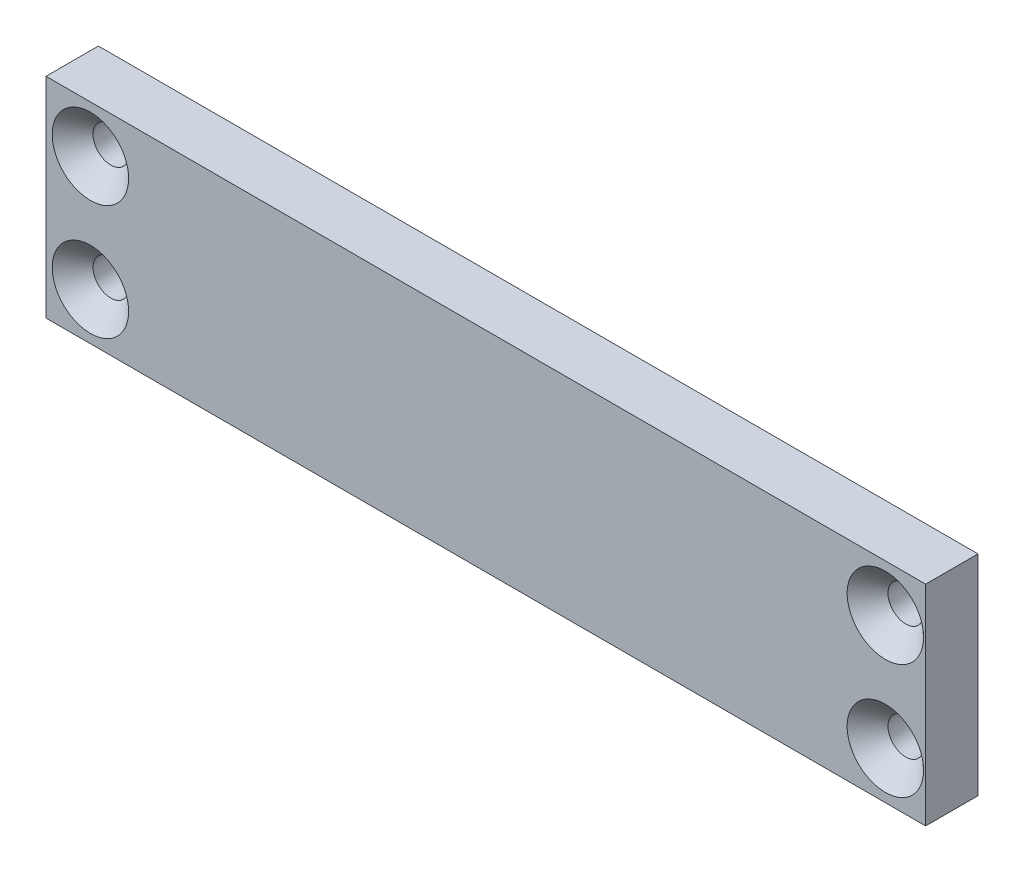
from build123d import *

# Parameters (mm, degrees)
SKETCH1_W                                       = 84
SKETCH1_H                                       = 20
BOSS_EXTRUDE1_DEPTH                             = 5
CSK_FOR_M3_FLAT_HEAD_MACHINE_SCREW1_D           = 3.4
CSK_FOR_M3_FLAT_HEAD_MACHINE_SCREW1_DEPTH       = 12
CSK_FOR_M3_FLAT_HEAD_MACHINE_SCREW1_CSINK_D     = 7.3
CSK_FOR_M3_FLAT_HEAD_MACHINE_SCREW1_CSINK_ANGLE = 90
CSK_FOR_M3_FLAT_HEAD_MACHINE_SCREW1_TIP         = 1.021463052


with BuildPart() as part:
    # Sketch1 → Boss-Extrude1 (new body)
    with BuildSketch(Plane.XY):
        Rectangle(SKETCH1_W, SKETCH1_H)
    extrude(amount=BOSS_EXTRUDE1_DEPTH)

    # CSK for M3 Flat Head Machine Screw1
    with Locations(Plane.XY.offset(5)):
        with Locations((38.153654124, 5.5), (38.153654124, -5.5), (-37.758420274, 5.5), (-37.758420274, -5.5)):
            CounterSinkHole(CSK_FOR_M3_FLAT_HEAD_MACHINE_SCREW1_D / 2, CSK_FOR_M3_FLAT_HEAD_MACHINE_SCREW1_CSINK_D / 2, depth=CSK_FOR_M3_FLAT_HEAD_MACHINE_SCREW1_DEPTH, counter_sink_angle=CSK_FOR_M3_FLAT_HEAD_MACHINE_SCREW1_CSINK_ANGLE)
            with Locations((0, 0, -(CSK_FOR_M3_FLAT_HEAD_MACHINE_SCREW1_DEPTH + CSK_FOR_M3_FLAT_HEAD_MACHINE_SCREW1_TIP / 2))):  # 118° drill point
                Cone(0, CSK_FOR_M3_FLAT_HEAD_MACHINE_SCREW1_D / 2, CSK_FOR_M3_FLAT_HEAD_MACHINE_SCREW1_TIP, mode=Mode.SUBTRACT)


solid = part.part
